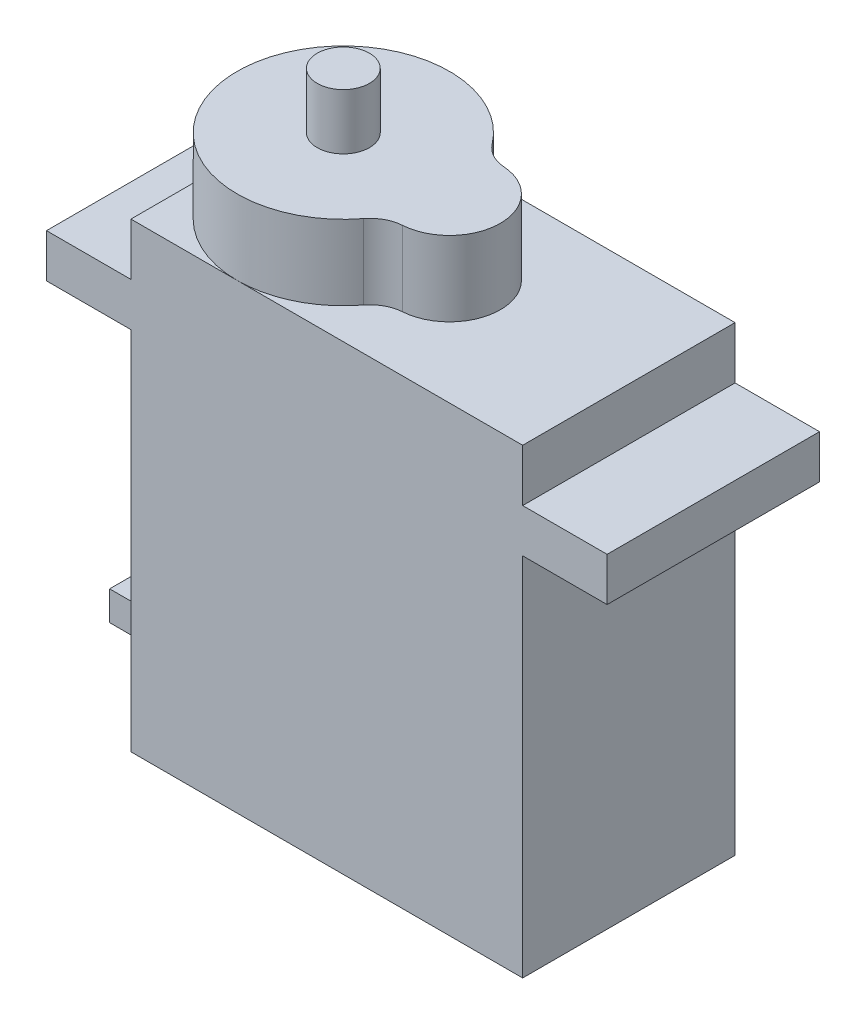
from build123d import *

# Parameters (mm, degrees)
BOSS_EXTRUDE1_DEPTH = 12.2
BOSS_EXTRUDE2_DEPTH = 4.3
SKETCH3_R           = 1.5
BOSS_EXTRUDE3_DEPTH = 3.2
SKETCH4_W           = 4.645747774
SKETCH4_H           = 1.682483887
BOSS_EXTRUDE4_DEPTH = 5


with BuildPart() as part:
    # Sketch1 → Boss-Extrude1 (new body)
    with BuildSketch(Plane.XY):
        Polygon((-11.25, 0), (11.25, 0), (11.25, 21), (16.1, 21), (16.1, 23.5), (11.25, 23.5), (11.25, 26.5), (-11.25, 26.5), (-11.25, 23.5), (-16.1, 23.5), (-16.1, 21), (-11.25, 21), align=None)
    extrude(amount=BOSS_EXTRUDE1_DEPTH)

    # Sketch2 → Boss-Extrude2 (add)
    with BuildSketch(Plane(origin=(0, 26.5, 0), x_dir=(1, 0, 0), z_dir=(0, 1, 0))):
        with BuildLine():
            ThreePointArc((-0.298176495, -2.402729564), (-11.25, -6.1), (-0.298176495, -9.797270436))
            ThreePointArc((-0.298176495, -9.797270436), (0.343135361, -9.249221864), (1.153363413, -9.014341819))
            ThreePointArc((1.153363413, -9.014341819), (3.871428575, -6.1), (1.153363413, -3.185658181))
            ThreePointArc((1.153363413, -3.185658181), (0.343135361, -2.950778136), (-0.298176495, -2.402729564))
        make_face()
    extrude(amount=BOSS_EXTRUDE2_DEPTH)

    # Sketch3 → Boss-Extrude3 (add)
    with BuildSketch(Plane(origin=(0, 30.8, 0), x_dir=(1, 0, 0), z_dir=(0, 1, 0))):
        with Locations(Location((-5.15, -6.1, 0), (0, 0, 270))):
            Circle(SKETCH3_R)
    extrude(amount=BOSS_EXTRUDE3_DEPTH)

    # Sketch4 → Boss-Extrude4 (add)
    with BuildSketch(Plane.ZY.offset(11.25)):
        with Locations((6.1, 2.87779749)):
            Rectangle(SKETCH4_W, SKETCH4_H)
    extrude(amount=BOSS_EXTRUDE4_DEPTH)


solid = part.part
